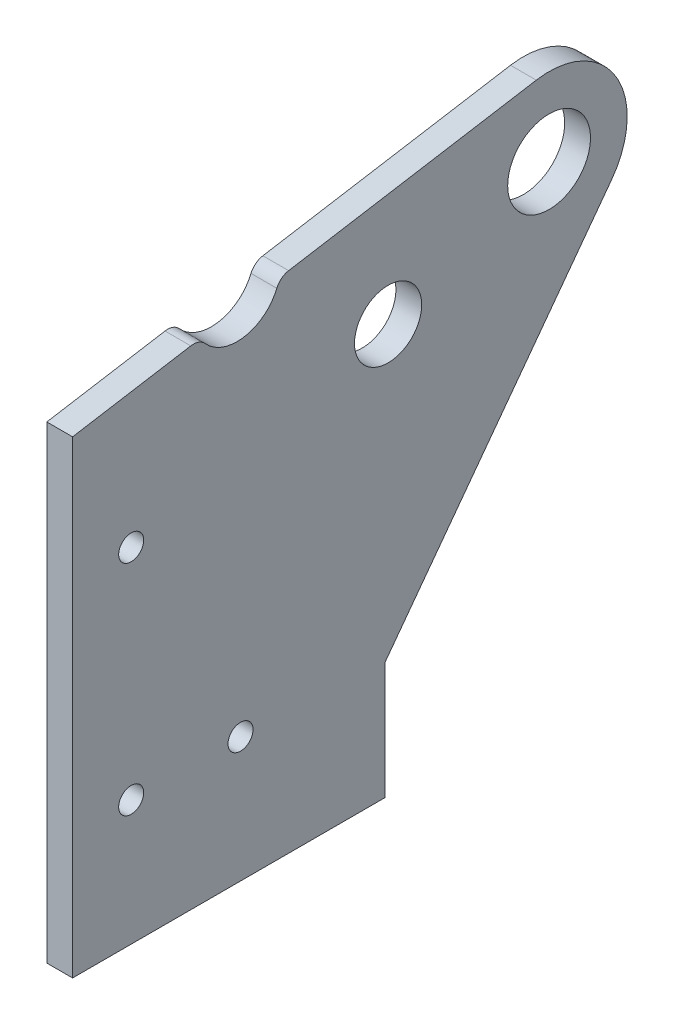
from build123d import *

# Parameters (mm, degrees)
SKETCH1_R           = 4.3
SKETCH1_R_2         = 5.3
BOSS_EXTRUDE1_DEPTH = 3.3
SKETCH2_R           = 5.5
CUT_EXTRUDE1_DEPTH  = 93.907965213
FILLET1_R           = 2
SKETCH3_R           = 1.6
CUT_EXTRUDE2_DEPTH  = 93.907965213


with BuildPart() as part:
    # Sketch1 → Boss-Extrude1 (new body)
    with BuildSketch(Plane.ZY.offset(39)):
        with BuildLine():
            Line((61, 0), (21, 0))
            Line((21, 0), (21, 15))
            Line((21, 15), (-8.024613022, 54.032958367))
            ThreePointArc((-8.024613022, 54.032958367), (-8.535456817, 65.210180123), (1.639344262, 69.864712383))
            Line((1.639344262, 69.864712383), (61, 60))
            Line((61, 60), (61, 0))
        make_face()
        with Locations((20.609637027, 52.303061543)):
            Circle(SKETCH1_R, mode=Mode.SUBTRACT)
        with Locations((0, 60)):
            Circle(SKETCH1_R_2, mode=Mode.SUBTRACT)
    extrude(amount=BOSS_EXTRUDE1_DEPTH)

    # Sketch2 → Cut-Extrude1 (cut, through all)
    with BuildSketch(Plane.ZY.offset(42.3)):
        with Locations((39.931128277, 65.523132673)):
            Circle(SKETCH2_R)
    extrude(amount=-CUT_EXTRUDE1_DEPTH, mode=Mode.SUBTRACT)

    # Fillet1
    fillet1_edges = [part.edges().sort_by_distance(p)[0] for p in [
        (-40.65, 62.71535211, 44.660437774),
        (-40.65, 64.395883156, 34.547884968),
    ]]
    fillet(fillet1_edges, radius=FILLET1_R)

    # Sketch3 → Cut-Extrude2 (cut, through all)
    with BuildSketch(Plane(origin=(-39, 0, 0), x_dir=(0, 0, -1), z_dir=(1, 0, 0))):
        with Locations((-53.5, 44)):
            Circle(SKETCH3_R)
        with Locations((-39.5, 16)):
            Circle(SKETCH3_R)
        with Locations((-53.5, 16)):
            Circle(SKETCH3_R)
    extrude(amount=-CUT_EXTRUDE2_DEPTH, mode=Mode.SUBTRACT)


solid = part.part
